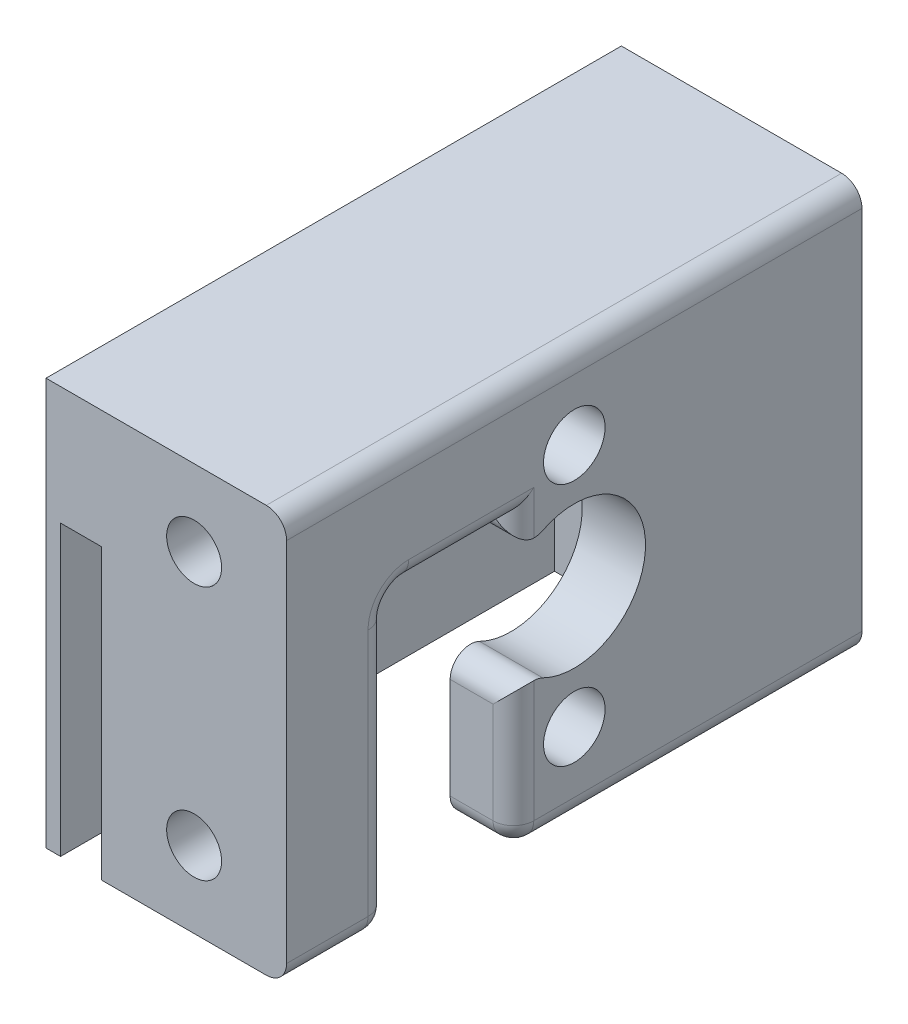
from build123d import *

# Parameters (mm, degrees)
SKETCH1_W           = 23.65
SKETCH1_H           = 40
BOSS_EXTRUDE1_DEPTH = 56.55
SKETCH2_W           = 16
SKETCH2_H           = 28.38
CUT_EXTRUDE1_DEPTH  = 62.137002911
SKETCH3_R           = 7
CUT_EXTRUDE2_DEPTH  = 6.2205
SKETCH6_R           = 3.025
CUT_EXTRUDE4_DEPTH  = 8
SKETCH4_W           = 11.968
SKETCH4_H           = 10
BOSS_EXTRUDE2_DEPTH = 28.38
SKETCH5_W           = 12.292
SKETCH5_H           = 28.38
CUT_EXTRUDE3_DEPTH  = 6.2205
FILLET5_R           = 2
SKETCH9_W           = 8
SKETCH9_H           = 11
BOSS_EXTRUDE3_DEPTH = 16
SKETCH8_R           = 2.7
CUT_EXTRUDE6_DEPTH  = 6
SKETCH7_R           = 2.7
CUT_EXTRUDE5_DEPTH  = 8
FILLET4_R           = 2


with BuildPart() as part:
    # Sketch1 → Boss-Extrude1 (new body)
    with BuildSketch(Plane.XY):
        Rectangle(SKETCH1_W, SKETCH1_H)
    extrude(amount=BOSS_EXTRUDE1_DEPTH)

    # Sketch2 → Cut-Extrude1 (cut, through all)
    with BuildSketch(Plane.XY.offset(56.55)):
        with Locations((-2.3955, -5.81)):
            Rectangle(SKETCH2_W, SKETCH2_H)
    extrude(amount=-CUT_EXTRUDE1_DEPTH, mode=Mode.SUBTRACT)

    # Sketch3 → Cut-Extrude2 (cut)
    with BuildSketch(Plane(origin=(11.825, 0, 0), x_dir=(0, 0, -1), z_dir=(1, 0, 0))):
        with Locations(Location((-28.275, 0, 0), (0, 0, 90))):
            Circle(SKETCH3_R)
    extrude(amount=-CUT_EXTRUDE2_DEPTH, mode=Mode.SUBTRACT)

    # Sketch6 → Cut-Extrude4 (cut)
    with BuildSketch(Plane(origin=(11.825, 0, 0), x_dir=(0, 0, -1), z_dir=(1, 0, 0))):
        with Locations(Location((-28.275, 12, 0), (0, 0, 90))):
            Circle(SKETCH6_R)
        with Locations(Location((-28.275, -12, 0), (0, 0, 90))):
            Circle(SKETCH6_R)
    extrude(amount=-CUT_EXTRUDE4_DEPTH, mode=Mode.SUBTRACT)

    # Sketch4 → Boss-Extrude2 (add)
    with BuildSketch(Plane.XZ.offset(-8.38)):
        with Locations((-0.3795, 51.55)):
            Rectangle(SKETCH4_W, SKETCH4_H)
    extrude(amount=BOSS_EXTRUDE2_DEPTH)

    # Sketch5 → Cut-Extrude3 (cut)
    with BuildSketch(Plane(origin=(11.825, 0, 0), x_dir=(0, 0, -1), z_dir=(1, 0, 0))):
        with Locations((-40.404, -5.81)):
            Rectangle(SKETCH5_W, SKETCH5_H)
    extrude(amount=-CUT_EXTRUDE3_DEPTH, mode=Mode.SUBTRACT)

    # Fillet5
    fillet5_edges = [part.edges().sort_by_distance(p)[0] for p in [
        (5.6045, 8.38, 17.129),
    ]]
    fillet(fillet5_edges, radius=FILLET5_R)

    # Sketch9 → Boss-Extrude3 (add)
    with BuildSketch(Plane(origin=(-10.3955, 0, 0), x_dir=(0, 0, -1), z_dir=(1, 0, 0))):
        with Locations((-4, -14.5)):
            Rectangle(SKETCH9_W, SKETCH9_H)
    extrude(amount=BOSS_EXTRUDE3_DEPTH)

    # Sketch8 → Cut-Extrude6 (cut)
    with BuildSketch(Plane(origin=(0, 0, 0), x_dir=(-1, 0, 0), z_dir=(0, 0, -1))):
        with Locations((0, 14.19)):
            Circle(SKETCH8_R)
        with Locations((0, -14.5)):
            Circle(SKETCH8_R)
    extrude(amount=-CUT_EXTRUDE6_DEPTH, mode=Mode.SUBTRACT)

    # Sketch7 → Cut-Extrude5 (cut)
    with BuildSketch(Plane.XY.offset(56.55)):
        with Locations((2.73075, 12.5)):
            Circle(SKETCH7_R)
        with Locations((2.73075, -12.5)):
            Circle(SKETCH7_R)
    extrude(amount=-CUT_EXTRUDE5_DEPTH, mode=Mode.SUBTRACT)

    # Fillet4
    fillet4_edges = [part.edges().sort_by_distance(p)[0] for p in [
        (5.6045, -14.5, 8),
        (5.6045, -9, 4),
        (2.73075, -20, 46.55),
        (2.73075, 8.38, 46.55),
        (8.71475, 3.633691099, 34.258),
        (8.71475, -3.633691099, 34.258),
        (11.825, -20, 17.129),
        (11.825, 8.38, 40.404),
        (11.825, -11.816845549, 34.258),
        (11.825, 6.006845549, 34.258),
        (11.825, -5.81, 46.55),
        (8.71475, -20, 34.258),
        (11.825, -20, 51.55),
        (11.825, 20, 28.275),
    ]]
    fillet(fillet4_edges, radius=FILLET4_R)


solid = part.part
